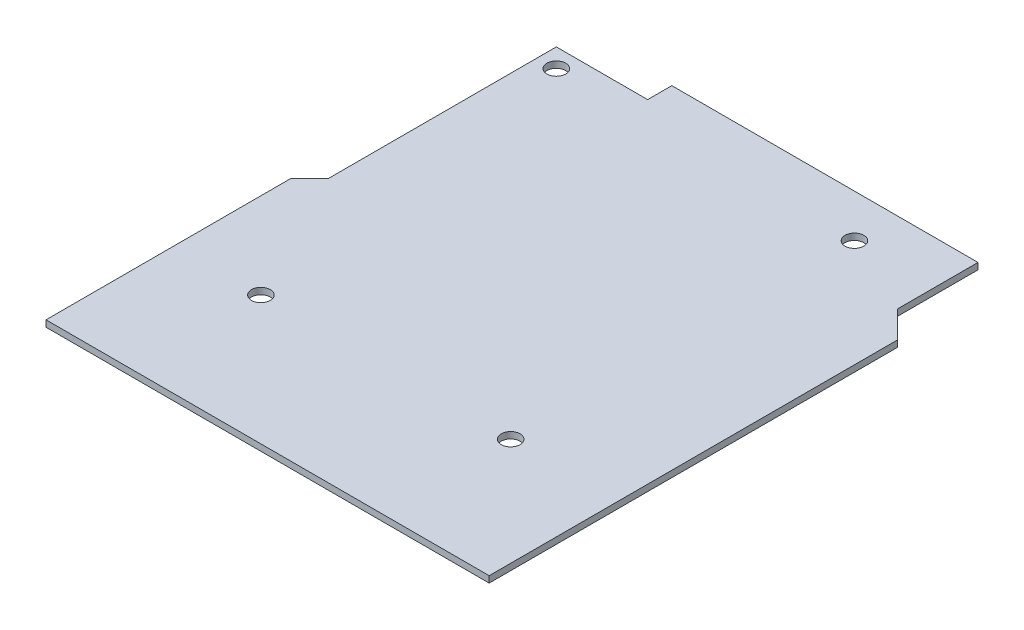
from build123d import *

# Parameters (mm, degrees)
SKETCH1_R = 1.75
PCB_DEPTH = 1.2


with BuildPart() as part:
    # Sketch1 → PCB (new body)
    with BuildSketch(Plane(origin=(0, 0, 0), x_dir=(1, 0, 0), z_dir=(0, 1, 0))):
        Polygon((0, 0), (0, 45.5), (3.5, 49), (3.5, 91.5), (20.5, 91.5), (20.5, 96), (77.5, 96), (77.5, 81), (82.5, 76), (82.5, 0), align=None)
        with Locations(Location((7, 88, 0), (0, 0, 270))):
            Circle(SKETCH1_R, mode=Mode.SUBTRACT)
        with Locations(Location((62.5, 88, 0), (0, 0, 270))):
            Circle(SKETCH1_R, mode=Mode.SUBTRACT)
        with Locations(Location((62.5, 24, 0), (0, 0, 270))):
            Circle(SKETCH1_R, mode=Mode.SUBTRACT)
        with Locations(Location((16, 24, 0), (0, 0, 270))):
            Circle(SKETCH1_R, mode=Mode.SUBTRACT)
    extrude(amount=PCB_DEPTH)


solid = part.part
